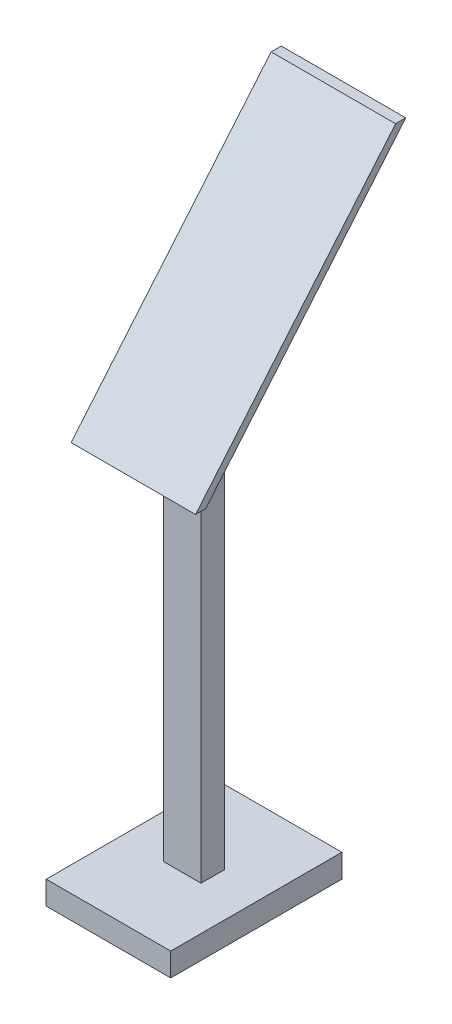
from build123d import *

# Parameters (mm, degrees)
EXTRUDE_1_DEPTH     = 40
CUT_EXTRUDE_1_DEPTH = 28


with BuildPart() as part:
    # 草图1 → 凸台-拉伸1 (new, symmetric)
    with BuildSketch(Plane(origin=(0, 0, 0), x_dir=(0, 0, -1), z_dir=(1, 0, 0))):
        Polygon((55, 0), (-55, 0), (-55, 15), (-7.5, 15), (-7.5, 279.793839815), (-32.5, 250), (-39.027036447, 250), (89.530485491, 403.208888624), (96.057521937, 403.208888624), (7.5, 297.670143704), (7.5, 15), (55, 15), align=None)
    extrude(amount=EXTRUDE_1_DEPTH, both=True)

    # 草图2 → 切除-拉伸1 (cut)
    with BuildSketch(Plane(origin=(40, 0, 0), x_dir=(0, 0, -1), z_dir=(1, 0, 0))):
        Polygon((-7.5, 279.793839815), (7.5, 297.670143704), (7.5, 15), (-7.5, 15), align=None)
    cut_extrude_1 = extrude(amount=-CUT_EXTRUDE_1_DEPTH, mode=Mode.SUBTRACT)

    # 镜向1: 切除-拉伸1 across plane
    add(cut_extrude_1.mirror(Plane(origin=(0, 0, 0), x_dir=(0, 0, 1), z_dir=(1, 0, 0))), mode=Mode.SUBTRACT)


solid = part.part
